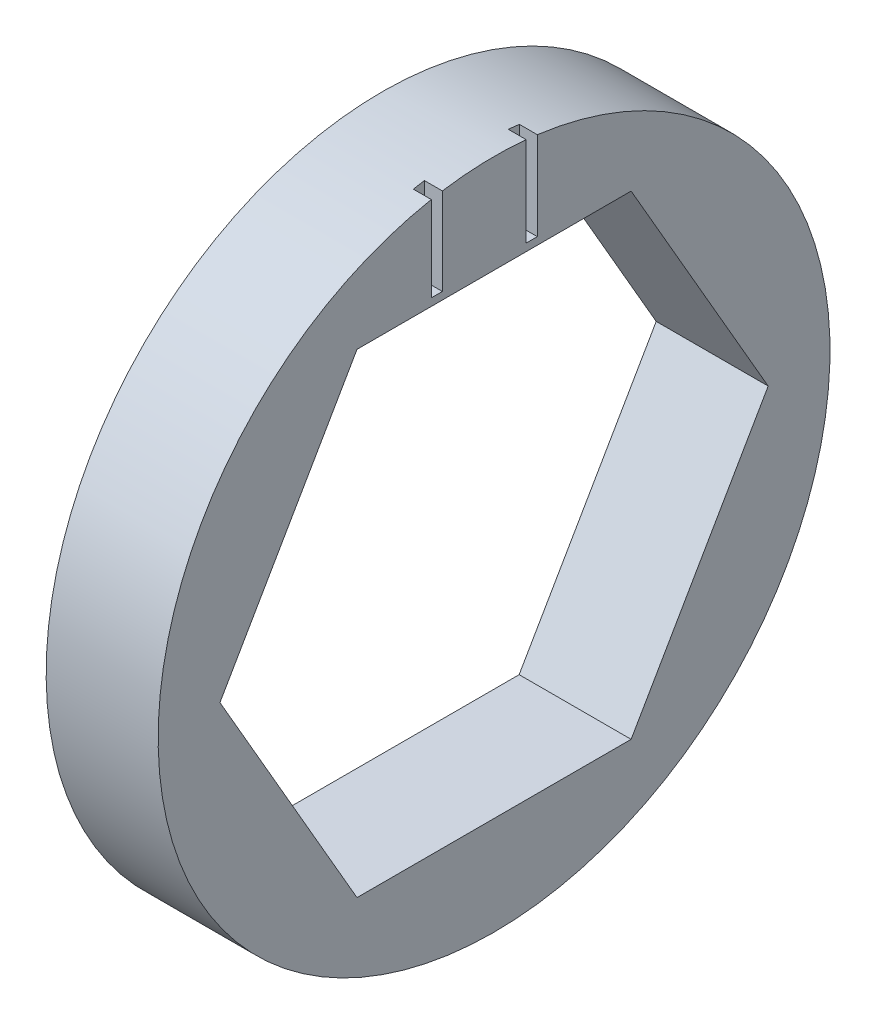
from build123d import *

# Parameters (mm, degrees)
SKETCH1_R           = 9.525
BOSS_EXTRUDE1_DEPTH = 3.175
CUT_EXTRUDE1_DEPTH  = 0.508


with BuildPart() as part:
    # Sketch1 → Boss-Extrude1 (new body)
    with BuildSketch(Plane(origin=(0, 0, 0), x_dir=(0, 0, -1), z_dir=(1, 0, 0))):
        Circle(SKETCH1_R)
        Polygon((7.772289324, 0), (3.886144662, 6.731), (-3.886144662, 6.731), (-7.772289324, 0), (-3.886144662, -6.731), (3.886144662, -6.731), align=None, mode=Mode.SUBTRACT)
    extrude(amount=BOSS_EXTRUDE1_DEPTH)

    # Sketch2 → Cut-Extrude1 (cut)
    with BuildSketch(Plane(origin=(3.175, 0, 0), x_dir=(0, 0, -1), z_dir=(1, 0, 0))):
        Polygon((-2.112938805, 10.442477423), (-1.465803389, 10.442477423), (-1.465803389, 6.942477423), (-1.779905953, 6.942477423), (-1.779905953, 10.083503064), (-2.318367491, 10.083503064), align=None)
        Polygon((0.579368887, 10.442477423), (1.226504304, 10.442477423), (1.226504304, 6.942477423), (0.91240174, 6.942477423), (0.91240174, 10.083503064), (0.373940201, 10.083503064), align=None)
    extrude(amount=-CUT_EXTRUDE1_DEPTH, mode=Mode.SUBTRACT)


solid = part.part
